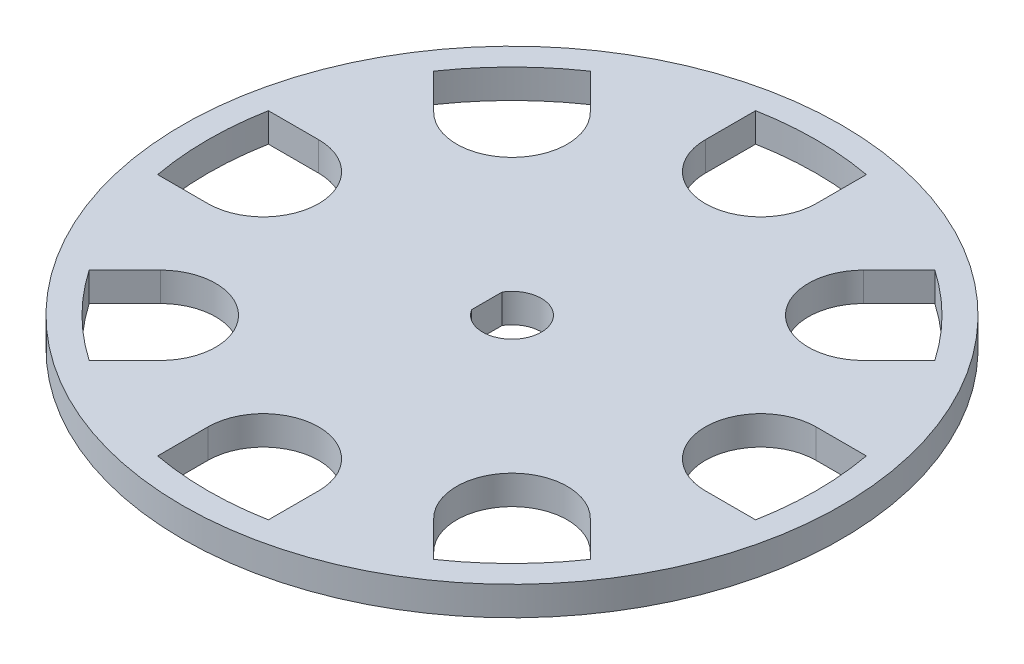
from build123d import *

# Parameters (mm, degrees)
SKETCH2_R           = 31.75
SKETCH2_R_2         = 29.294123568
BOSS_EXTRUDE1_DEPTH = 2.794
CUT_EXTRUDE1_DEPTH  = 46.01339384
CUT_EXTRUDE2_DEPTH  = 46.01339384


with BuildPart() as part:
    # Sketch2 → Boss-Extrude1 (new body)
    # profile 1 of 2: a face of its own
    with BuildSketch(Plane(origin=(0, 0, 0), x_dir=(1, 0, 0), z_dir=(0, 1, 0))):
        with Locations(Location((0, 0, 0), (0, 0, 270))):
            Circle(SKETCH2_R)
        Circle(SKETCH2_R_2, mode=Mode.SUBTRACT)
    # profile 2 of 2: a face of its own
    with BuildSketch(Plane(origin=(0, 0, 0), x_dir=(1, 0, 0), z_dir=(0, 1, 0))):
        Circle(SKETCH2_R_2)
    extrude(amount=BOSS_EXTRUDE1_DEPTH)

    # Sketch3 → Cut-Extrude1 (cut, through all)
    with BuildSketch(Plane(origin=(0, 3.175, 0), x_dir=(1, 0, 0), z_dir=(0, 1, 0))):
        with BuildLine():
            Line((5.334, -28.804411461), (5.334, -23.960123568))
            ThreePointArc((5.334, -23.960123568), (0, -18.626123568), (-5.334, -23.960123568))
            Line((-5.334, -23.960123568), (-5.334, -28.804411461))
            ThreePointArc((-5.334, -28.804411461), (0, -29.294123568), (5.334, -28.804411461))
        make_face()
        with BuildLine():
            Line((-20.714073424, -13.170658282), (-24.139502243, -16.596087101))
            ThreePointArc((-24.139502243, -16.596087101), (-20.714073424, -20.714073424), (-16.596087101, -24.139502243))
            Line((-16.596087101, -24.139502243), (-13.170658282, -20.714073424))
            ThreePointArc((-13.170658282, -20.714073424), (-13.170658282, -13.170658282), (-20.714073424, -13.170658282))
        make_face()
        with BuildLine():
            Line((-23.960123568, 5.334), (-28.804411461, 5.334))
            ThreePointArc((-28.804411461, 5.334), (-29.294123568, 0), (-28.804411461, -5.334))
            Line((-28.804411461, -5.334), (-23.960123568, -5.334))
            ThreePointArc((-23.960123568, -5.334), (-18.626123568, 0), (-23.960123568, 5.334))
        make_face()
        with BuildLine():
            Line((-13.170658282, 20.714073424), (-16.596087101, 24.139502243))
            ThreePointArc((-16.596087101, 24.139502243), (-20.714073424, 20.714073424), (-24.139502243, 16.596087101))
            Line((-24.139502243, 16.596087101), (-20.714073424, 13.170658282))
            ThreePointArc((-20.714073424, 13.170658282), (-13.170658282, 13.170658282), (-13.170658282, 20.714073424))
        make_face()
        with BuildLine():
            Line((5.334, 23.960123568), (5.334, 28.804411461))
            ThreePointArc((5.334, 28.804411461), (0, 29.294123568), (-5.334, 28.804411461))
            Line((-5.334, 28.804411461), (-5.334, 23.960123568))
            ThreePointArc((-5.334, 23.960123568), (0, 18.626123568), (5.334, 23.960123568))
        make_face()
        with BuildLine():
            Line((20.714073424, 13.170658282), (24.139502243, 16.596087101))
            ThreePointArc((24.139502243, 16.596087101), (20.714073424, 20.714073424), (16.596087101, 24.139502243))
            Line((16.596087101, 24.139502243), (13.170658282, 20.714073424))
            ThreePointArc((13.170658282, 20.714073424), (13.170658282, 13.170658282), (20.714073424, 13.170658282))
        make_face()
        with BuildLine():
            Line((23.960123568, -5.334), (28.804411461, -5.334))
            ThreePointArc((28.804411461, -5.334), (29.294123568, 0), (28.804411461, 5.334))
            Line((28.804411461, 5.334), (23.960123568, 5.334))
            ThreePointArc((23.960123568, 5.334), (18.626123568, 0), (23.960123568, -5.334))
        make_face()
        with BuildLine():
            Line((13.170658282, -20.714073424), (16.596087101, -24.139502243))
            ThreePointArc((16.596087101, -24.139502243), (20.714073424, -20.714073424), (24.139502243, -16.596087101))
            Line((24.139502243, -16.596087101), (20.714073424, -13.170658282))
            ThreePointArc((20.714073424, -13.170658282), (13.170658282, -13.170658282), (13.170658282, -20.714073424))
        make_face()
    extrude(amount=-CUT_EXTRUDE1_DEPTH, mode=Mode.SUBTRACT)

    # Sketch4 → Cut-Extrude2 (cut, through all)
    with BuildSketch(Plane(origin=(0, 3.175, 0), x_dir=(1, 0, 0), z_dir=(0, 1, 0))):
        with BuildLine():
            Line((-2.413, -1.470474094), (-2.413, 1.470474094))
            ThreePointArc((-2.413, 1.470474094), (2.82575, 0), (-2.413, -1.470474094))
        make_face()
    extrude(amount=-CUT_EXTRUDE2_DEPTH, mode=Mode.SUBTRACT)


solid = part.part
